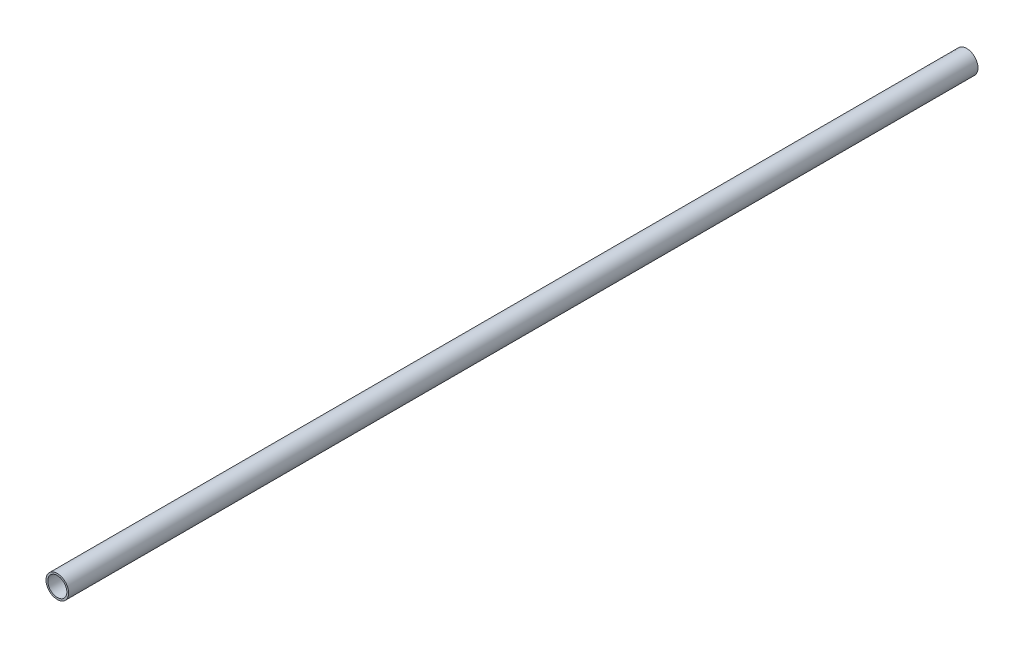
from build123d import *

# Parameters (mm, degrees)
CROQUIS1_R              = 12.7
CROQUIS1_R_2            = 10.7
SALIENTE_EXTRUIR1_DEPTH = 1020


with BuildPart() as part:
    # Croquis1 → Saliente-Extruir1 (new body)
    with BuildSketch(Plane.XY):
        Circle(CROQUIS1_R)
        Circle(CROQUIS1_R_2, mode=Mode.SUBTRACT)
    extrude(amount=SALIENTE_EXTRUIR1_DEPTH)


solid = part.part
